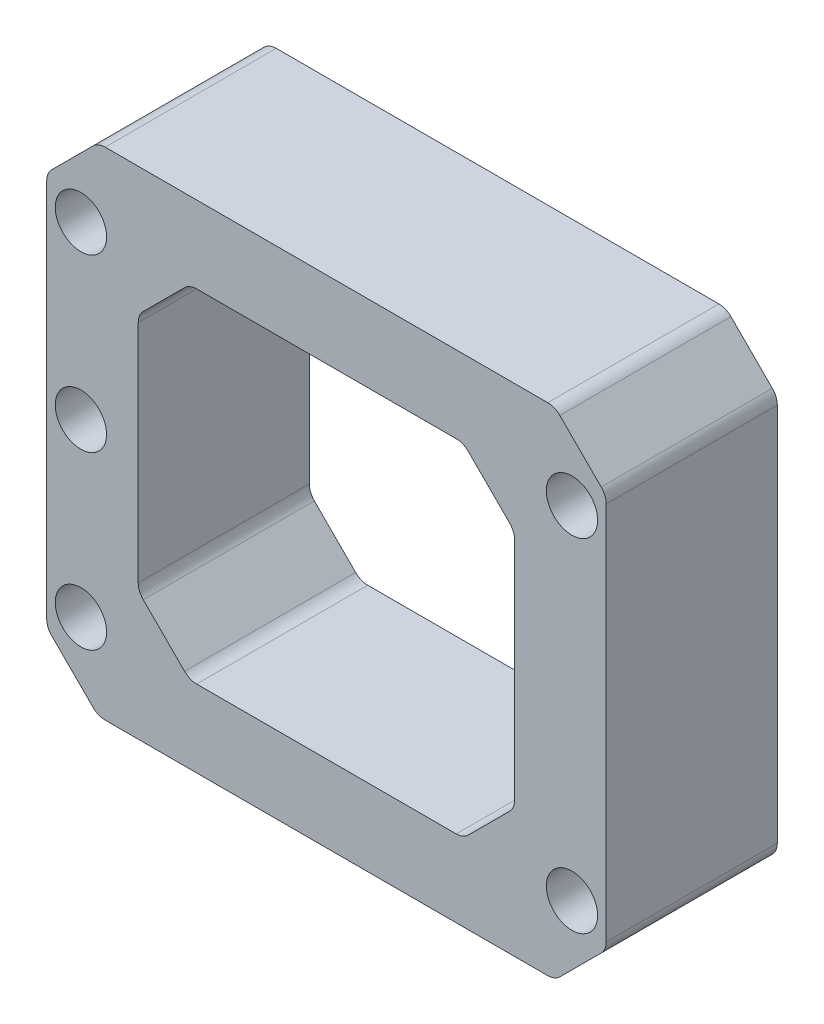
from build123d import *

# Parameters (mm, degrees)
SKETCH_1_W          = 32.7
SKETCH_1_H          = 29
SKETCH_1_R          = 1.5
EXTRUDE_1_DEPTH     = 10
CHAMFER_1_SIZE      = 3
CUT_EXTRUDE_1_DEPTH = 25.032738088
FILLET_1_R          = 1


with BuildPart() as part:
    # 草图1 → 凸台-拉伸1 (new body)
    with BuildSketch(Plane.XY):
        Rectangle(SKETCH_1_W, SKETCH_1_H)
        with Locations((-14.35, -10)):
            Circle(SKETCH_1_R, mode=Mode.SUBTRACT)
        with Locations((-14.35, 10)):
            Circle(SKETCH_1_R, mode=Mode.SUBTRACT)
        with Locations((14.35, 10)):
            Circle(SKETCH_1_R, mode=Mode.SUBTRACT)
        with Locations((14.35, -10)):
            Circle(SKETCH_1_R, mode=Mode.SUBTRACT)
        with Locations((-14.35, 0)):
            Circle(SKETCH_1_R, mode=Mode.SUBTRACT)
    extrude(amount=EXTRUDE_1_DEPTH)

    # 倒角1
    chamfer_1_edges = [part.edges().sort_by_distance(p)[0] for p in [
        (16.35, -14.5, 5),
        (-16.35, -14.5, 5),
        (-16.35, 14.5, 5),
        (16.35, 14.5, 5),
    ]]
    chamfer(chamfer_1_edges, length=CHAMFER_1_SIZE)

    # 草图2 → 切除-拉伸1 (cut, through all)
    with BuildSketch(Plane.XY.offset(10)):
        Polygon((-11, 7), (-8, 10), (8, 10), (11, 7), (11, -7), (8, -10), (-8, -10), (-11, -7), align=None)
    extrude(amount=-CUT_EXTRUDE_1_DEPTH, mode=Mode.SUBTRACT)

    # 圆角1
    fillet_1_edges = [part.edges().sort_by_distance(p)[0] for p in [
        (16.35, 11.5, 5),
        (16.35, -11.5, 5),
        (-13.35, -14.5, 5),
        (13.35, -14.5, 5),
        (-13.35, 14.5, 5),
        (13.35, 14.5, 5),
        (-16.35, 11.5, 5),
        (-16.35, -11.5, 5),
        (-8, 10, 5),
        (8, 10, 5),
        (11, 7, 5),
        (11, -7, 5),
        (8, -10, 5),
        (-8, -10, 5),
        (-11, -7, 5),
        (-11, 7, 5),
    ]]
    fillet(fillet_1_edges, radius=FILLET_1_R)


solid = part.part
